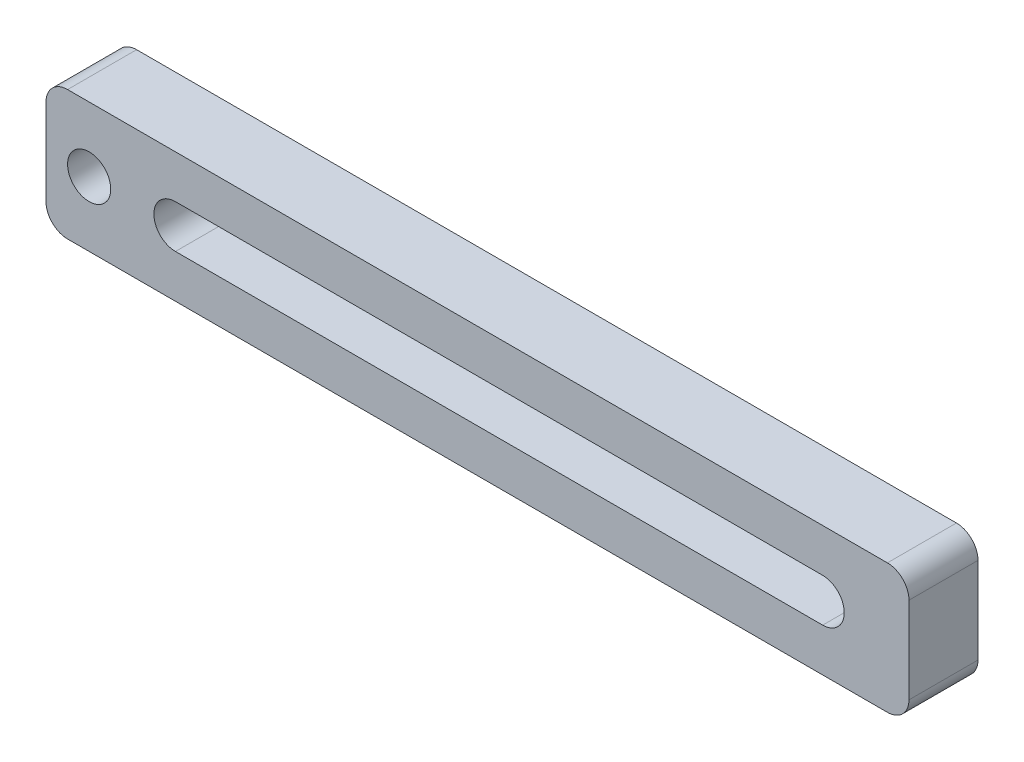
from build123d import *

# Parameters (mm, degrees)
SKETCH_1_W          = 100
SKETCH_1_H          = 15
EXTRUDE_1_DEPTH     = 8
SKETCH_2_R          = 2.5
CUT_EXTRUDE_2_DEPTH = 8
FILLET_2_R          = 2.5


with BuildPart() as part:
    # Эскиз1 → Вытянуть1 (new body)
    with BuildSketch(Plane.XY):
        with Locations((50, 7.5)):
            Rectangle(SKETCH_1_W, SKETCH_1_H)
    extrude(amount=EXTRUDE_1_DEPTH)

    # Эскиз2 → Вытянуть2 (cut)
    with BuildSketch(Plane.XY.offset(8)):
        with Locations((5, 7.5)):
            Circle(SKETCH_2_R)
        with BuildLine():
            Line((15, 10), (90, 10))
            ThreePointArc((90, 10), (92.5, 7.5), (90, 5))
            Line((90, 5), (15, 5))
            ThreePointArc((15, 5), (12.5, 7.5), (15, 10))
        make_face()
    extrude(amount=-CUT_EXTRUDE_2_DEPTH, mode=Mode.SUBTRACT)

    # Скругление2
    fillet_2_edges = [part.edges().sort_by_distance(p)[0] for p in [
        (0, 15, 4),
        (100, 15, 4),
        (100, 0, 4),
        (0, 0, 4),
    ]]
    fillet(fillet_2_edges, radius=FILLET_2_R)


solid = part.part
